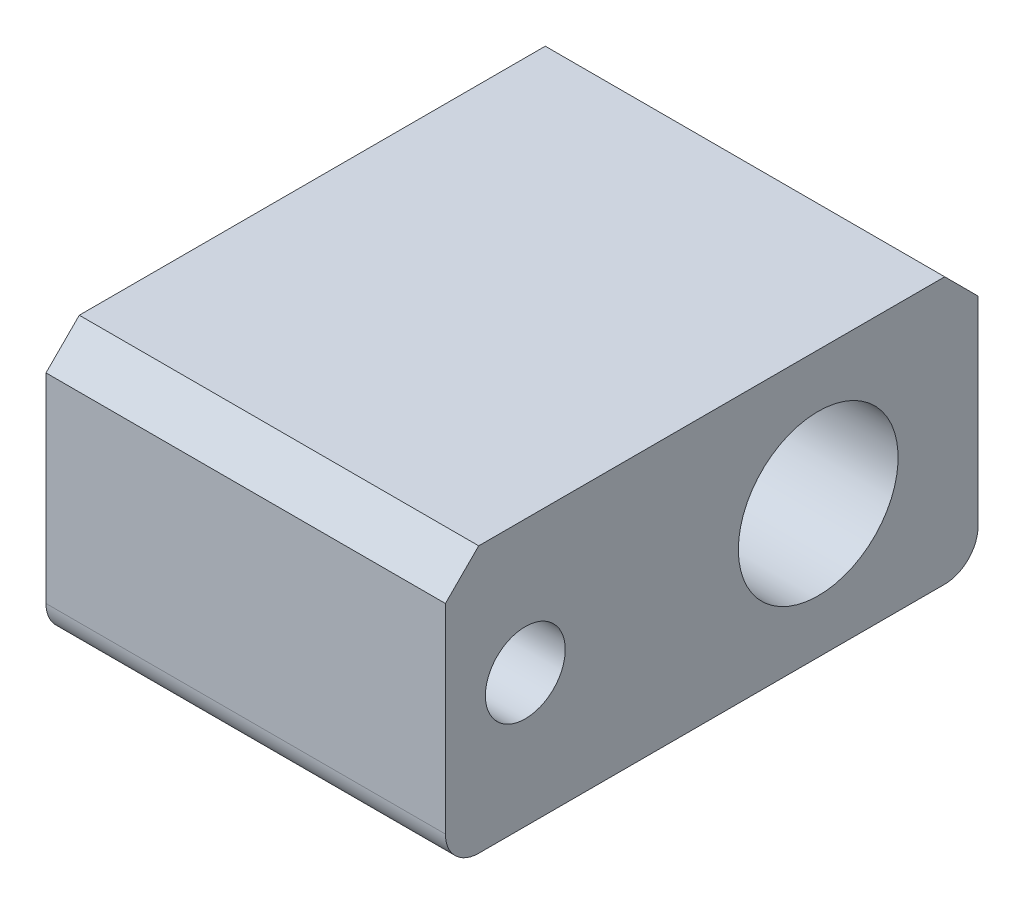
from build123d import *

# Parameters (mm, degrees)
SKETCH1_W           = 50.8
SKETCH1_H           = 101.6
SKETCH1_R           = 15.24
SKETCH1_R_2         = 7.62
BOSS_EXTRUDE1_DEPTH = 76.2
FILLET1_R           = 6.35
CHAMFER1_SIZE       = 6.35


with BuildPart() as part:
    # Sketch1 → Boss-Extrude1 (new body)
    with BuildSketch(Plane.YZ):
        Rectangle(SKETCH1_W, SKETCH1_H)
        with Locations(Location((0, -20.32, 0), (0, 0, 90))):
            Circle(SKETCH1_R, mode=Mode.SUBTRACT)
        with Locations(Location((0, 35.56, 0), (0, 0, 90))):
            Circle(SKETCH1_R_2, mode=Mode.SUBTRACT)
    extrude(amount=BOSS_EXTRUDE1_DEPTH)

    # Fillet1
    fillet1_edges = [part.edges().sort_by_distance(p)[0] for p in [
        (38.1, -25.4, 50.8),
        (38.1, -25.4, -50.8),
    ]]
    fillet(fillet1_edges, radius=FILLET1_R)

    # Chamfer1
    chamfer1_edges = [part.edges().sort_by_distance(p)[0] for p in [
        (38.1, 25.4, 50.8),
        (38.1, 25.4, -50.8),
    ]]
    chamfer(chamfer1_edges, length=CHAMFER1_SIZE)


solid = part.part
